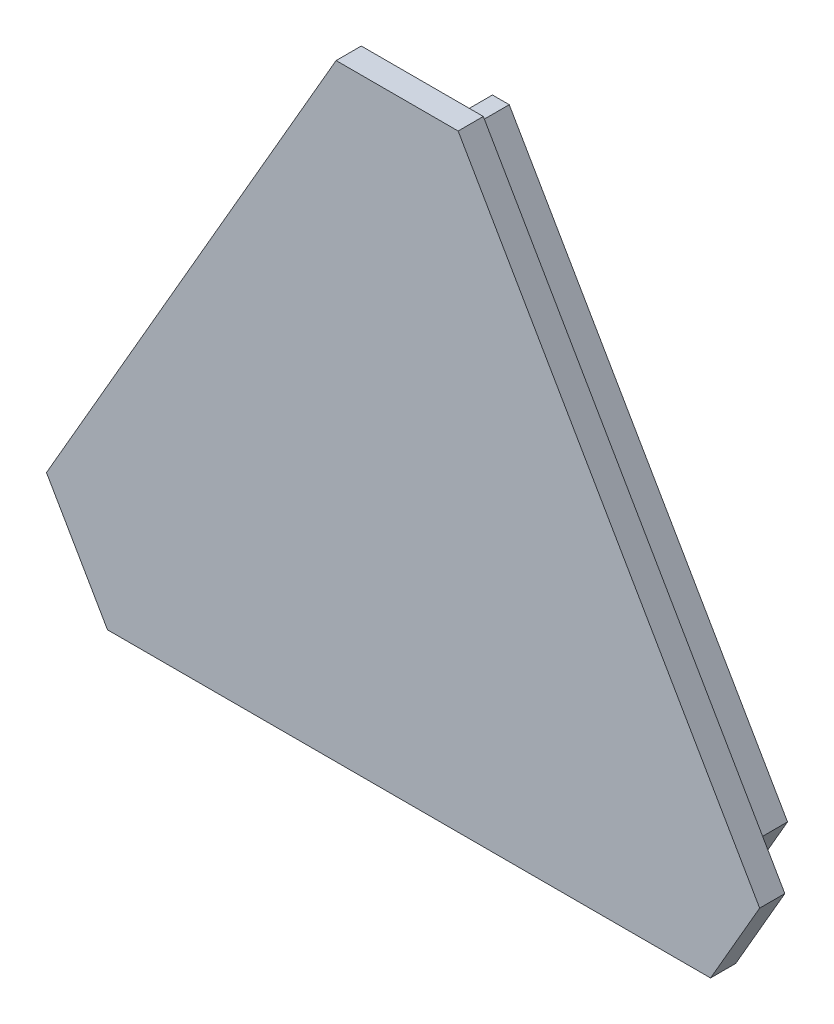
from build123d import *

# Parameters (mm, degrees)
BOSS_EXTRUDE1_DEPTH = 10
BOSS_EXTRUDE2_DEPTH = 5


with BuildPart() as part:
    # Sketch2 → Boss-Extrude1 (new body)
    with BuildSketch(Plane.XY):
        Polygon((77.769059892, 108.719200877), (133.038119785, 12.990381057), (125.769059892, 0.4), (15.230940108, 0.4), (13.562177826, 3.290381057), (14.780166891, 5.4), (122.882308546, 5.4), (127.264617093, 12.990381057), (73.213546265, 106.609581934), (74.43153533, 108.719200877), align=None)
    extrude(amount=-BOSS_EXTRUDE1_DEPTH)

    # Sketch3 → Boss-Extrude2 (add)
    with BuildSketch(Plane.XY):
        Polygon((58.381197846, 114.119200877), (82.618802154, 114.119200877), (142.504165125, 10.394709581), (132.75, -6.5), (12.979274058, -6.5), (0.860471904, 14.490381057), align=None)
    extrude(amount=BOSS_EXTRUDE2_DEPTH)


solid = part.part
